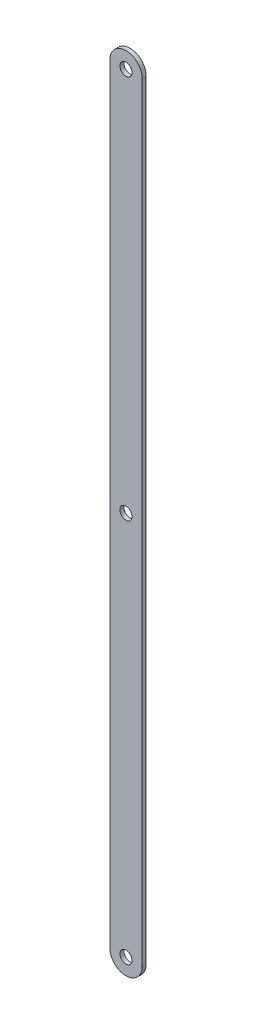
from build123d import *

# Parameters (mm, degrees)
SKETCH1_R           = 7.5
BOSS_EXTRUDE1_DEPTH = 5


with BuildPart() as part:
    # Sketch1 → Boss-Extrude1 (new body)
    with BuildSketch(Plane.XY):
        with BuildLine():
            Line((20, 475), (20, -475))
            ThreePointArc((20, -475), (0, -495), (-20, -475))
            Line((-20, -475), (-20, 475))
            ThreePointArc((-20, 475), (0, 495), (20, 475))
        make_face()
        with Locations((0, 475)):
            Circle(SKETCH1_R, mode=Mode.SUBTRACT)
        Circle(SKETCH1_R, mode=Mode.SUBTRACT)
        with Locations((0, -475)):
            Circle(SKETCH1_R, mode=Mode.SUBTRACT)
    extrude(amount=BOSS_EXTRUDE1_DEPTH)


solid = part.part
